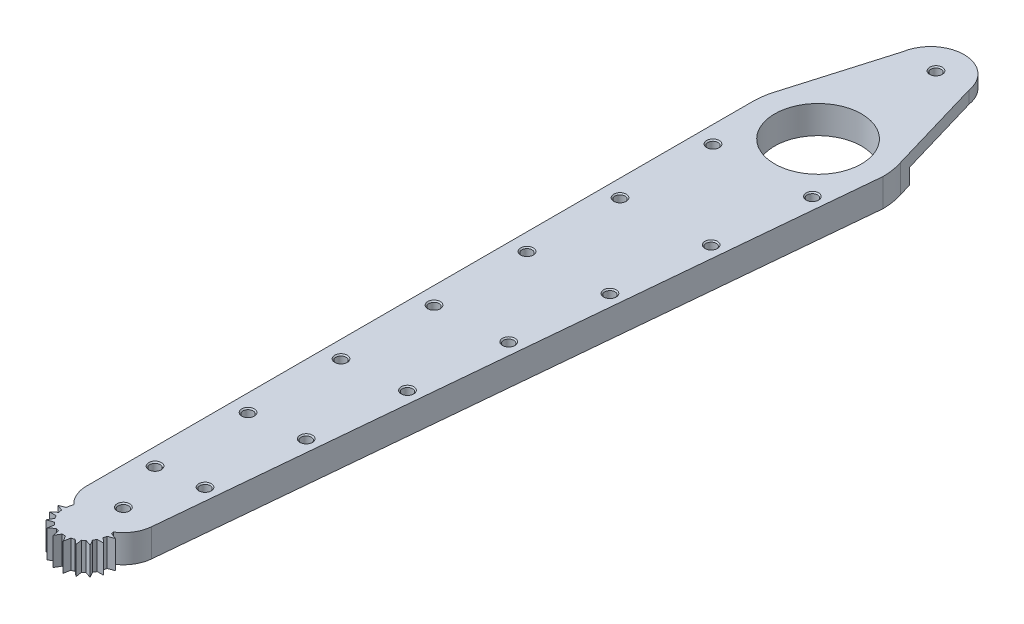
from build123d import *
from build123d.topology import SkipClean

# Parameters (mm, degrees)
EXTRUDE_1_DEPTH               = 15
CUT_EXTRUDE_1_DEPTH           = 4
SKETCH_3_R                    = 14
CUT_EXTRUDE_2_DEPTH           = 227.475164201
EXTRUDE_4_DEPTH               = 15
SKETCH_11_W                   = 17
SKETCH_11_H                   = 10
SKETCH_14_W                   = 6
SKETCH_14_H                   = 10
CUT_REVOLVE_4_ANGLE           = 60
CUT_REVOLVE_4_OTHER_WAY_ANGLE = 90
SKETCH_16_W                   = 9.609453317
SKETCH_16_H                   = 10
CUT_EXTRUDE_4_DEPTH           = 5
SKETCH_17_W                   = 9.609453317
SKETCH_17_H                   = 10
CUT_EXTRUDE_5_DEPTH           = 5
CUT_EXTRUDE_6_DEPTH           = 7.5
EXTRUDE_START                 = 1.5
EXTRUDE_6_DEPTH               = 1.5
SKETCH_21_R                   = 5
SKETCH_21_R_2                 = 14
EXTRUDE_7_DEPTH               = 1.5
HOLE_WIZARD_M4_1_D            = 3.3
HOLE_WIZARD_M4_1_DEPTH        = 9
HOLE_WIZARD_M4_1_CSINK_D      = 4.05
HOLE_WIZARD_M4_1_CSINK_ANGLE  = 90
SKETCH_25_R                   = 5
CUT_EXTRUDE_7_DEPTH           = 5
EXTRUDE_8_DEPTH               = 9


with BuildPart() as part:
    # 草图1 → 凸台-拉伸1 (new body)
    with BuildSketch(Plane(origin=(0, 0, 0), x_dir=(1, 0, 0), z_dir=(0, 1, 0))):
        with BuildLine():
            Line((-21, 0), (-21, -215))
            ThreePointArc((-21, -215), (-18.071067812, -222.071067812), (-11, -225))
            Line((-11, -225), (-9.110127779, -225))
            ThreePointArc((-9.110127779, -225), (-2.375625019, -222.392325249), (0.846599179, -215.929294516))
            Line((0.846599179, -215.929294516), (21, 0))
            ThreePointArc((21, 0), (0, 21), (-21, 0))
        make_face()
    extrude(amount=EXTRUDE_1_DEPTH)

    # 草图2 → 切除-拉伸1 (cut)
    with BuildSketch(Plane.XZ):
        with BuildLine():
            Line((-6.487547308, 24.545681698), (-15.16946684, 197.954199749))
            ThreePointArc((-15.16946684, 197.954199749), (-9.006726896, 204.766554422), (-2.194372223, 198.603814478))
            Line((-2.194372223, 198.603814478), (6.487547308, 25.195296427))
            ThreePointArc((6.487547308, 25.195296427), (0.324807364, 18.382941754), (-6.487547308, 24.545681698))
        make_face()
    extrude(amount=-CUT_EXTRUDE_1_DEPTH, mode=Mode.SUBTRACT)

    # 草图3 → 切除-拉伸2 (cut, through all)
    with BuildSketch(Plane(origin=(0, 0, 0), x_dir=(-1, 0, 0), z_dir=(0, -1, 0))):
        with Locations(Location((0, 0, 0), (0, 0, 90))):
            Circle(SKETCH_3_R)
    extrude(amount=-CUT_EXTRUDE_2_DEPTH, mode=Mode.SUBTRACT)

    # 草图7 → 凸台-拉伸4 (add)
    with BuildSketch(Plane(origin=(0, 0, 0), x_dir=(1, 0, 0), z_dir=(0, 1, 0))):
        with BuildLine():
            Line((-10.693069191, 38.039100971), (-19.9158097, 6.66036966))
            ThreePointArc((-19.9158097, 6.66036966), (0, 21), (19.9158097, 6.66036966))
            Line((19.9158097, 6.66036966), (10.693069191, 38.039100971))
            ThreePointArc((10.693069191, 38.039100971), (0, 47.113526612), (-10.693069191, 38.039100971))
        make_face()
    extrude(amount=EXTRUDE_4_DEPTH)

    # 草图11 → 切除-旋转3 (revolve, cut)
    with BuildSketch(Plane(origin=(0, 0, 0), x_dir=(0, 0, -1), z_dir=(1, 0, 0)), mode=Mode.PRIVATE) as cut_revolve_3_sk:
        with Locations((51.539100971, 7.5)):
            Rectangle(SKETCH_11_W, SKETCH_11_H)
    revolve(cut_revolve_3_sk.sketch.rotate(Axis((0, 15, -38.039100971), (0, -1, 0)), 180), axis=Axis((0, 15, -38.039100971), (0, -1, 0)), mode=Mode.SUBTRACT)

    # 草图14 → 切除-旋转4 (revolve, cut)
    with BuildSketch(Plane(origin=(0, 0, 0), x_dir=(0, 0, -1), z_dir=(1, 0, 0))):
        with Locations((19.26034239, 7.5)):
            Rectangle(SKETCH_14_W, SKETCH_14_H)
    revolve(axis=Axis((0, 15, 0), (0, -1, 0)), revolution_arc=CUT_REVOLVE_4_ANGLE, mode=Mode.SUBTRACT)

    # 草图14 → 切除-旋转4 other way (revolve, cut)
    with BuildSketch(Plane(origin=(0, 0, 0), x_dir=(0, 0, -1), z_dir=(1, 0, 0))):
        with Locations((19.26034239, 7.5)):
            Rectangle(SKETCH_14_W, SKETCH_14_H)
    revolve(axis=Axis((0, 15, 0), (0, 1, 0)), revolution_arc=CUT_REVOLVE_4_OTHER_WAY_ANGLE, mode=Mode.SUBTRACT)

    # 草图16 → 切除-拉伸4 (cut)
    with BuildSketch(Plane(origin=(20.13407913, 0, -5.917746812), x_dir=(-0.2819890835944097, 0, -0.9594176133121516), z_dir=(0.9594176133121516, 0, -0.2819890835944097))):
        with Locations((12.229144047, 7.5)):
            Rectangle(SKETCH_16_W, SKETCH_16_H)
    extrude(amount=-CUT_EXTRUDE_4_DEPTH, mode=Mode.SUBTRACT)

    # 草图17 → 切除-拉伸5 (cut)
    with BuildSketch(Plane(origin=(-20.13407913, 0, -5.917746812), x_dir=(-0.28198908359441, 0, 0.9594176133121515), z_dir=(-0.9594176133121515, 0, -0.28198908359441))):
        with Locations((-12.229144047, 7.5)):
            Rectangle(SKETCH_17_W, SKETCH_17_H)
    extrude(amount=-CUT_EXTRUDE_5_DEPTH, mode=Mode.SUBTRACT)

    # 草图20 → 切除-拉伸6 (cut)
    with BuildSketch(Plane.XZ):
        with BuildLine():
            Line((21, 0), (0.846599179, 215.929294516))
            ThreePointArc((0.846599179, 215.929294516), (-2.375625019, 222.392325249), (-9.110127779, 225))
            Line((-9.110127779, 225), (-11, 225))
            ThreePointArc((-11, 225), (-18.071067812, 222.071067812), (-21, 215))
            Line((-21, 215), (-21, 0))
            ThreePointArc((-21, 0), (-20.727180268, -3.374018102), (-19.9158097, -6.66036966))
            Line((-19.9158097, -6.66036966), (-10.693069191, -38.039100971))
            ThreePointArc((-10.693069191, -38.039100971), (0, -47.113526612), (10.693069191, -38.039100971))
            Line((10.693069191, -38.039100971), (19.9158097, -6.66036966))
            ThreePointArc((19.9158097, -6.66036966), (20.727180268, -3.374018102), (21, 0))
        make_face()
    extrude(amount=-CUT_EXTRUDE_6_DEPTH, mode=Mode.SUBTRACT)

    # 草图22 → 凸台-拉伸6 (add)
    with BuildSketch(Plane.XZ.offset(-12.5).offset(EXTRUDE_START)):
        with BuildLine():
            Line((-19.9158097, -6.66036966), (-10.693069191, -38.039100971))
            ThreePointArc((-10.693069191, -38.039100971), (0, -47.113526612), (10.693069191, -38.039100971))
            Line((10.693069191, -38.039100971), (18.700124508, -10.796521919))
            Line((18.700124508, -10.796521919), (14.081869584, -8.130171195))
            ThreePointArc((14.081869584, -8.130171195), (8.995321483, -13.545586959), (2.030780118, -16.133030303))
            ThreePointArc((2.030780118, -16.133030303), (0, -16.039100971), (-2.030780118, -16.133030303))
            ThreePointArc((-2.030780118, -16.133030303), (-12.194669218, -10.755871759), (-16.26034239, 0))
            Line((-16.26034239, 0), (-21, 0))
            ThreePointArc((-21, 0), (-20.727180268, -3.374018102), (-19.9158097, -6.66036966))
        make_face()
    extrude(amount=-EXTRUDE_6_DEPTH)

    # 草图21 → 凸台-拉伸7 (add)
    # profile 1 of 2: a face of its own
    with SkipClean():  # the faces are left unmerged after this step: merging them gives an invalid solid
        with BuildSketch(Plane.XZ.offset(-7.5).offset(EXTRUDE_START)):
            with Locations(Location((0, -38.039100971, 0), (0, 0, 270))):
                Circle(SKETCH_21_R)
        # profile 2 of 2: a face of its own
        with BuildSketch(Plane.XZ.offset(-7.5).offset(EXTRUDE_START)):
            with BuildLine():
                Line((-21, 0), (-16.26034239, 0))
                ThreePointArc((-16.26034239, 0), (-12.194669218, -10.755871759), (-2.030780118, -16.133030303))
                ThreePointArc((-2.030780118, -16.133030303), (0, -16.039100971), (2.030780118, -16.133030303))
                ThreePointArc((2.030780118, -16.133030303), (8.995321483, -13.545586959), (14.081869584, -8.130171195))
                Line((14.081869584, -8.130171195), (18.700124508, -10.796521919))
                Line((18.700124508, -10.796521919), (19.9158097, -6.66036966))
                ThreePointArc((19.9158097, -6.66036966), (20.727180268, -3.374018102), (21, 0))
                Line((21, 0), (0.846599179, 215.929294516))
                ThreePointArc((0.846599179, 215.929294516), (-2.375625019, 222.392325249), (-9.110127779, 225))
                Line((-9.110127779, 225), (-11, 225))
                ThreePointArc((-11, 225), (-18.071067812, 222.071067812), (-21, 215))
                Line((-21, 215), (-21, 0))
            make_face()
            with Locations(Location((0, 0, 0), (0, 0, 270))):
                Circle(SKETCH_21_R_2, mode=Mode.SUBTRACT)
        extrude(amount=-EXTRUDE_7_DEPTH)

    # M4 螺纹孔1
    with Locations(Plane(origin=(0, 15, 0), x_dir=(1, 0, 0), z_dir=(0, 1, 0))):
        with Locations((-1.550565844, -196.226581502), (-4.338449392, -226.096762374), (-9.110127779, -215), (15.176735444, -17.005496271), (0, 38.039100971), (-15.5, -18.398087501), (-15.5, -48.398087501), (-15.5, -78.398087501), (-15.5, -108.398087501), (-15.5, -138.398087501), (-15.5, -168.398087501), (-15.5, -198.398087501), (12.388851896, -46.875677143), (9.600968348, -76.745858014), (6.8130848, -106.616038886), (4.025201252, -136.486219758), (1.237317704, -166.35640063)):
            CounterSinkHole(HOLE_WIZARD_M4_1_D / 2, HOLE_WIZARD_M4_1_CSINK_D / 2, depth=HOLE_WIZARD_M4_1_DEPTH, counter_sink_angle=HOLE_WIZARD_M4_1_CSINK_ANGLE)

    # 草图25 → 切除-拉伸7 (cut)
    with BuildSketch(Plane.XZ.offset(-6)):
        with Locations((0, -38.039100971)):
            Circle(SKETCH_25_R)
    extrude(amount=-CUT_EXTRUDE_7_DEPTH, mode=Mode.SUBTRACT)

    # 草图26 → 凸台-拉伸8 (add)
    with BuildSketch(Plane(origin=(0, 15, 0), x_dir=(1, 0, 0), z_dir=(0, 1, 0))):
        with BuildLine():
            Line((-18.307809651, -224.266369979), (-20.284097218, -225))
            Line((-20.284097218, -225), (-18.307809651, -225.733630021))
            ThreePointArc((-18.307809651, -225.733630021), (-18.232961751, -226.275366307), (-18.118011048, -226.810031388))
            Line((-18.118011048, -226.810031388), (-19.724197646, -228.175348261))
            Line((-19.724197646, -228.175348261), (-17.616178559, -228.188804821))
            ThreePointArc((-17.616178559, -228.188804821), (-17.360559817, -228.672270922), (-17.069675262, -229.135376297))
            Line((-17.069675262, -229.135376297), (-18.112031083, -230.967702659))
            Line((-18.112031083, -230.967702659), (-16.126538687, -230.259362699))
            ThreePointArc((-16.126538687, -230.259362699), (-15.720980497, -230.626245467), (-15.289247061, -230.961933794))
            Line((-15.289247061, -230.961933794), (-15.642048609, -233.040264042))
            Line((-15.642048609, -233.040264042), (-14.018562591, -231.695563814))
            ThreePointArc((-14.018562591, -231.695563814), (-13.511981254, -231.901611775), (-12.991472361, -232.069394086))
            Line((-12.991472361, -232.069394086), (-12.612166563, -234.14305092))
            Line((-12.612166563, -234.14305092), (-11.546503297, -232.324181118))
            ThreePointArc((-11.546503297, -232.324181118), (-11, -232.344541845), (-10.453496703, -232.324181118))
            Line((-10.453496703, -232.324181118), (-9.387833437, -234.14305092))
            Line((-9.387833437, -234.14305092), (-9.008527639, -232.069394086))
            ThreePointArc((-9.008527639, -232.069394086), (-8.488018746, -231.901611775), (-7.981437409, -231.695563814))
            Line((-7.981437409, -231.695563814), (-6.357951391, -233.040264042))
            Line((-6.357951391, -233.040264042), (-6.710752939, -230.961933794))
            ThreePointArc((-6.710752939, -230.961933794), (-6.279019503, -230.626245467), (-5.873461313, -230.259362699))
            Line((-5.873461313, -230.259362699), (-3.887968917, -230.967702659))
            Line((-3.887968917, -230.967702659), (-4.930324738, -229.135376297))
            ThreePointArc((-4.930324738, -229.135376297), (-4.639440183, -228.672270922), (-4.383821441, -228.188804821))
            Line((-4.383821441, -228.188804821), (-2.275802354, -228.175348261))
            Line((-2.275802354, -228.175348261), (-3.881988952, -226.810031388))
            ThreePointArc((-3.881988952, -226.810031388), (-3.767038249, -226.275366307), (-3.692190349, -225.733630021))
            Line((-3.692190349, -225.733630021), (-1.715902782, -225))
            Line((-1.715902782, -225), (-3.692190349, -224.266369979))
            ThreePointArc((-3.692190349, -224.266369979), (-11, -217.655458155), (-18.307809651, -224.266369979))
        make_face()
    extrude(amount=-EXTRUDE_8_DEPTH)


solid = part.part
